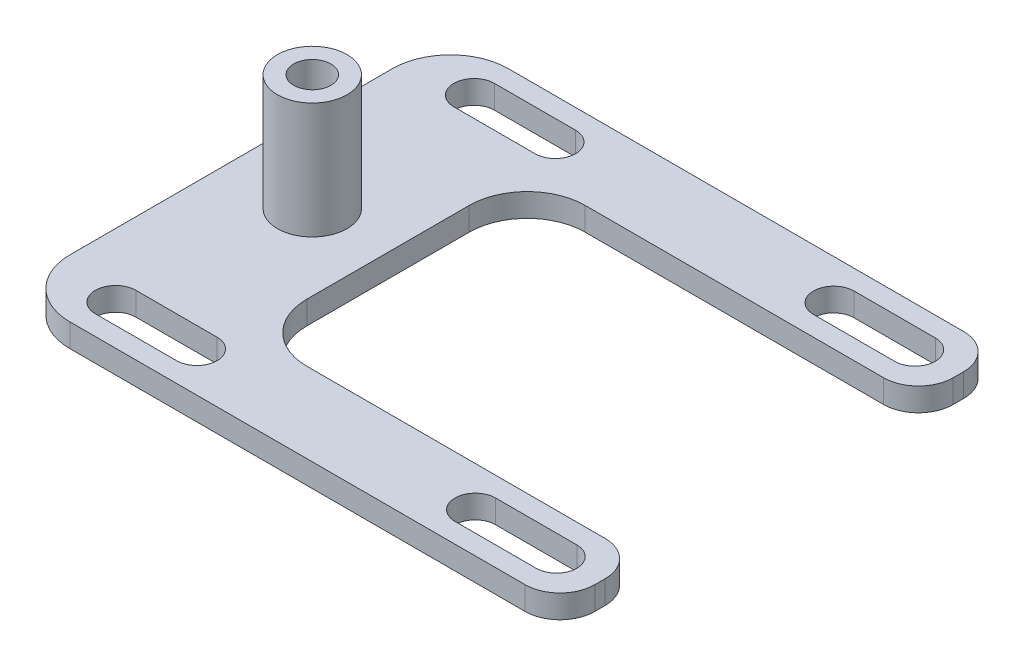
from build123d import *

# Parameters (mm, degrees)
BOSS_EXTRUDE1_DEPTH = 2
FILLET1_R           = 5
FILLET2_R           = 3
SKETCH2_R           = 3
SKETCH2_R_2         = 1.6
BOSS_EXTRUDE2_DEPTH = 10


with BuildPart() as part:
    # Sketch1 → Boss-Extrude1 (new body)
    with BuildSketch(Plane(origin=(0, 0, 0), x_dir=(1, 0, 0), z_dir=(0, 1, 0))):
        Polygon((47.24332582, 30.9), (47.24332582, 37.8), (0, 37.8), (0, 0), (47.24332582, 0), (47.24332582, 6.9), (13.518849419, 6.9), (13.518849419, 30.9), align=None)
        with BuildLine():
            Line((5.49332582, 36.1), (12.49332582, 36.1))
            ThreePointArc((12.49332582, 36.1), (14.24332582, 34.35), (12.49332582, 32.6))
            Line((12.49332582, 32.6), (5.49332582, 32.6))
            ThreePointArc((5.49332582, 32.6), (3.74332582, 34.35), (5.49332582, 36.1))
        make_face(mode=Mode.SUBTRACT)
        with BuildLine():
            Line((36.49332582, 36.1), (43.49332582, 36.1))
            ThreePointArc((43.49332582, 36.1), (45.24332582, 34.35), (43.49332582, 32.6))
            Line((43.49332582, 32.6), (36.49332582, 32.6))
            ThreePointArc((36.49332582, 32.6), (34.74332582, 34.35), (36.49332582, 36.1))
        make_face(mode=Mode.SUBTRACT)
        with BuildLine():
            Line((5.49332582, 5.2), (12.49332582, 5.2))
            ThreePointArc((12.49332582, 5.2), (14.24332582, 3.45), (12.49332582, 1.7))
            Line((12.49332582, 1.7), (5.49332582, 1.7))
            ThreePointArc((5.49332582, 1.7), (3.74332582, 3.45), (5.49332582, 5.2))
        make_face(mode=Mode.SUBTRACT)
        with BuildLine():
            Line((36.49332582, 5.2), (43.49332582, 5.2))
            ThreePointArc((43.49332582, 5.2), (45.24332582, 3.45), (43.49332582, 1.7))
            Line((43.49332582, 1.7), (36.49332582, 1.7))
            ThreePointArc((36.49332582, 1.7), (34.74332582, 3.45), (36.49332582, 5.2))
        make_face(mode=Mode.SUBTRACT)
    extrude(amount=BOSS_EXTRUDE1_DEPTH)

    # Fillet1
    fillet1_edges = [part.edges().sort_by_distance(p)[0] for p in [
        (13.518849419, 1, -6.9),
        (0, 1, 0),
        (0, 1, -37.8),
        (13.518849419, 1, -30.9),
    ]]
    fillet(fillet1_edges, radius=FILLET1_R)

    # Fillet2
    fillet2_edges = [part.edges().sort_by_distance(p)[0] for p in [
        (47.24332582, 1, -6.9),
        (47.24332582, 1, 0),
        (47.24332582, 1, -37.8),
        (47.24332582, 1, -30.9),
    ]]
    fillet(fillet2_edges, radius=FILLET2_R)

    # Sketch2 → Boss-Extrude2 (add)
    with BuildSketch(Plane(origin=(0, 2, 0), x_dir=(1, 0, 0), z_dir=(0, 1, 0))):
        with Locations(Location((6.99332582, 18.9, 0), (0, 0, 270))):
            Circle(SKETCH2_R)
        with Locations(Location((6.99332582, 18.9, 0), (0, 0, 270))):
            Circle(SKETCH2_R_2, mode=Mode.SUBTRACT)
    extrude(amount=BOSS_EXTRUDE2_DEPTH)


solid = part.part
